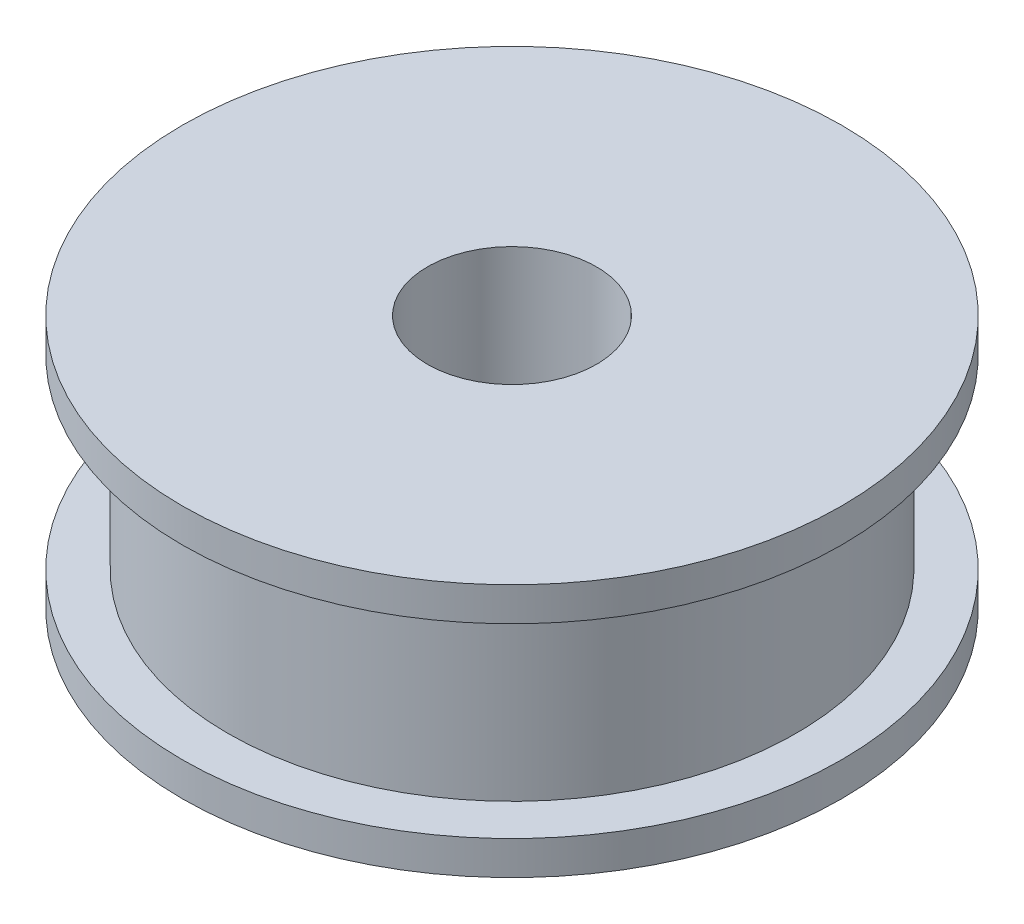
from build123d import *

# Parameters (mm, degrees)
SKETCH_2_R          = 5
CUT_EXTRUDE_1_DEPTH = 32.392674305


with BuildPart() as part:
    # 草图1 → 旋转1 (revolve)
    with BuildSketch(Plane.XY, mode=Mode.PRIVATE) as revolve_1_sk:
        Polygon((0, 0), (19.5, 0), (19.5, -2), (16.805, -2), (16.805, -13), (19.5, -13), (19.5, -15), (0, -15), align=None)
    revolve(revolve_1_sk.sketch.rotate(Axis((0, 23.575757576, 0), (0, -1, 0)), 90), axis=Axis((0, 23.575757576, 0), (0, -1, 0)))

    # 草图2 → 切除-拉伸1 (cut, through all)
    with BuildSketch(Plane(origin=(0, 0, 0), x_dir=(1, 0, 0), z_dir=(0, 1, 0))):
        with Locations(Location((0, 0, 0), (0, 0, 270))):
            Circle(SKETCH_2_R)
    extrude(amount=-CUT_EXTRUDE_1_DEPTH, mode=Mode.SUBTRACT)


solid = part.part
